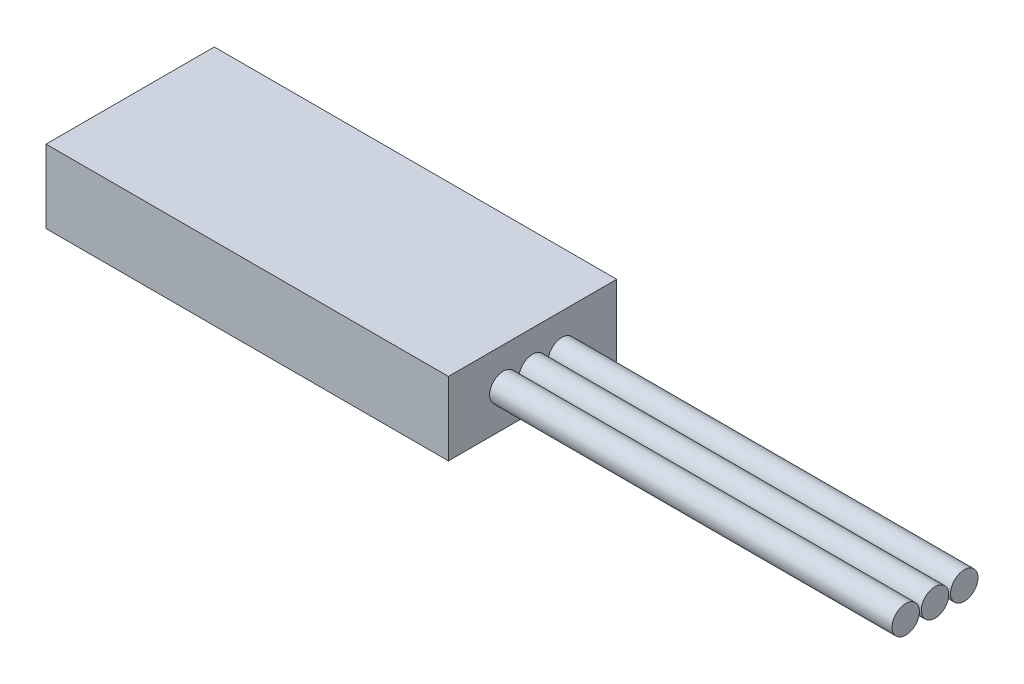
from build123d import *

# Parameters (mm, degrees)
SKETCH1_W           = 9.2
SKETCH1_H           = 4
BOSS_EXTRUDE1_DEPTH = 22
SHELL1_T            = -0.5
SKETCH2_2_R         = 0.75
BOSS_EXTRUDE2_DEPTH = 22


with BuildPart() as part:
    # Sketch1 → Boss-Extrude1 (new body)
    with BuildSketch(Plane(origin=(0, 0, 0), x_dir=(0, 0, -1), z_dir=(1, 0, 0))):
        Rectangle(SKETCH1_W, SKETCH1_H)
    extrude(amount=BOSS_EXTRUDE1_DEPTH)

    # Shell1
    shell1_openings = [part.faces().sort_by_distance(p)[0] for p in [
        (0, 0, 0),
    ]]
    offset(amount=SHELL1_T, openings=shell1_openings, kind=Kind.INTERSECTION)

    # Sketch2<2> → Boss-Extrude2 (add)
    with BuildSketch(Plane(origin=(22, 0, 0), x_dir=(0, 0, -1), z_dir=(1, 0, 0))):
        Circle(SKETCH2_2_R)
        with Locations((-1.6, 0)):
            Circle(SKETCH2_2_R)
        with Locations((1.6, 0)):
            Circle(SKETCH2_2_R)
    extrude(amount=BOSS_EXTRUDE2_DEPTH)


solid = part.part
